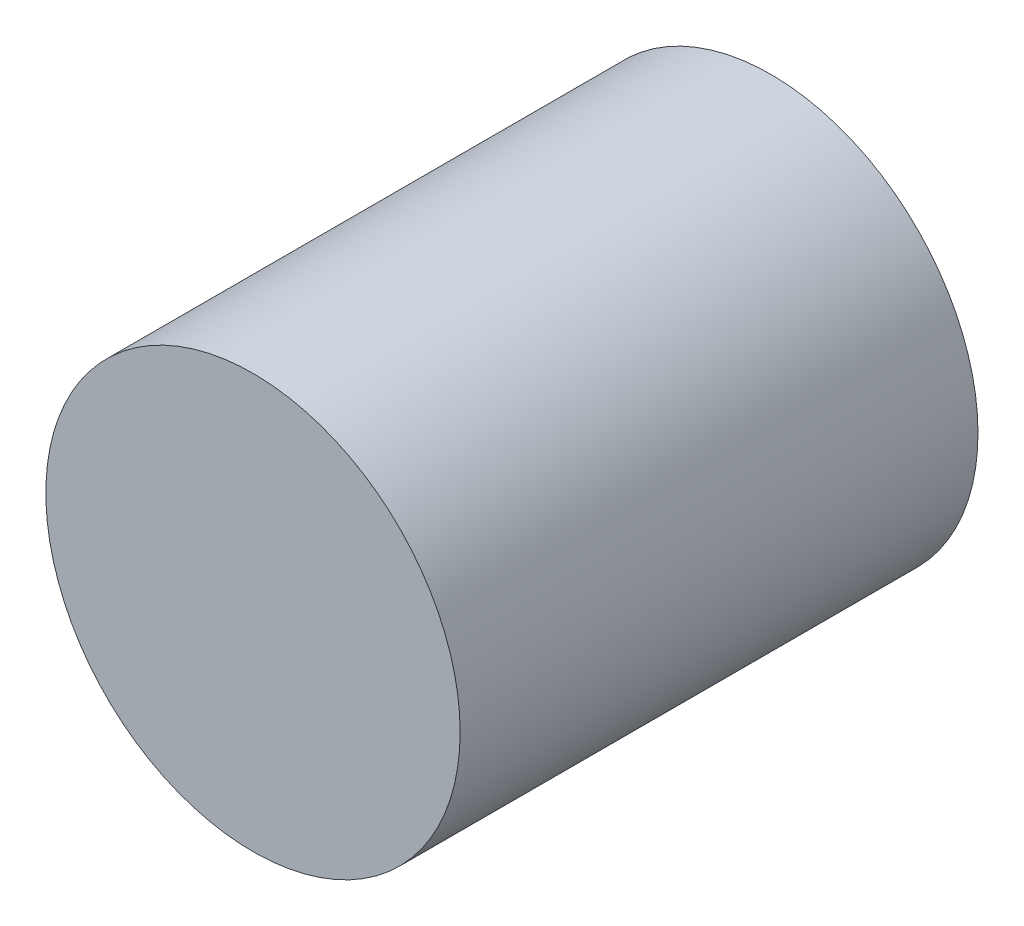
from build123d import *

# Parameters (mm, degrees)
SKETCH_1_R      = 2
EXTRUDE_1_DEPTH = 2.5


with BuildPart() as part:
    # 草圖1 → 填料-伸長1 (new, symmetric)
    with BuildSketch(Plane.XY):
        Circle(SKETCH_1_R)
    extrude(amount=EXTRUDE_1_DEPTH, both=True)


solid = part.part
